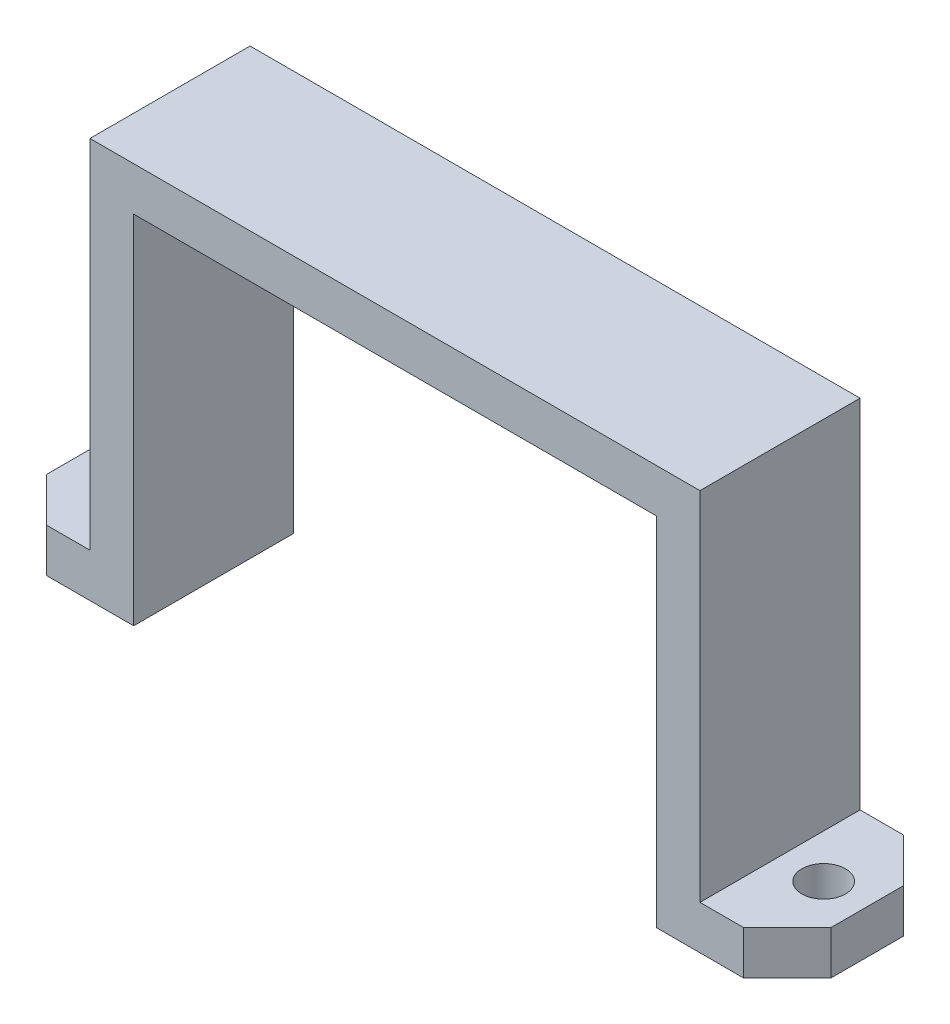
from build123d import *

# Parameters (mm, degrees)
BOSS_EXTRUDE1_DEPTH = 11
CHAMFER1_SIZE       = 3
SKETCH2_R           = 1.5
CUT_EXTRUDE1_DEPTH  = 39.050256569


with BuildPart() as part:
    # Sketch1 → Boss-Extrude1 (new body)
    with BuildSketch(Plane.XY):
        Polygon((-26.955, 0), (-17.955, 0), (-17.955, 24.5), (17.955, 24.5), (17.955, 0), (26.955, 0), (26.955, 3), (20.955, 3), (20.955, 27.5), (-20.955, 27.5), (-20.955, 3), (-26.955, 3), align=None)
    extrude(amount=BOSS_EXTRUDE1_DEPTH)

    # Chamfer1
    chamfer1_edges = [part.edges().sort_by_distance(p)[0] for p in [
        (-26.955, 1.5, 0),
        (26.955, 1.5, 0),
        (26.955, 1.5, 11),
        (-26.955, 1.5, 11),
    ]]
    chamfer(chamfer1_edges, length=CHAMFER1_SIZE)

    # Sketch2 → Cut-Extrude1 (cut, through all)
    with BuildSketch(Plane(origin=(0, 3, 0), x_dir=(1, 0, 0), z_dir=(0, 1, 0))):
        with Locations(Location((-23.955, -5.5, 0), (0, 0, 180))):
            Circle(SKETCH2_R)
        with Locations((23.955, -5.5)):
            Circle(SKETCH2_R)
    extrude(amount=-CUT_EXTRUDE1_DEPTH, mode=Mode.SUBTRACT)


solid = part.part
